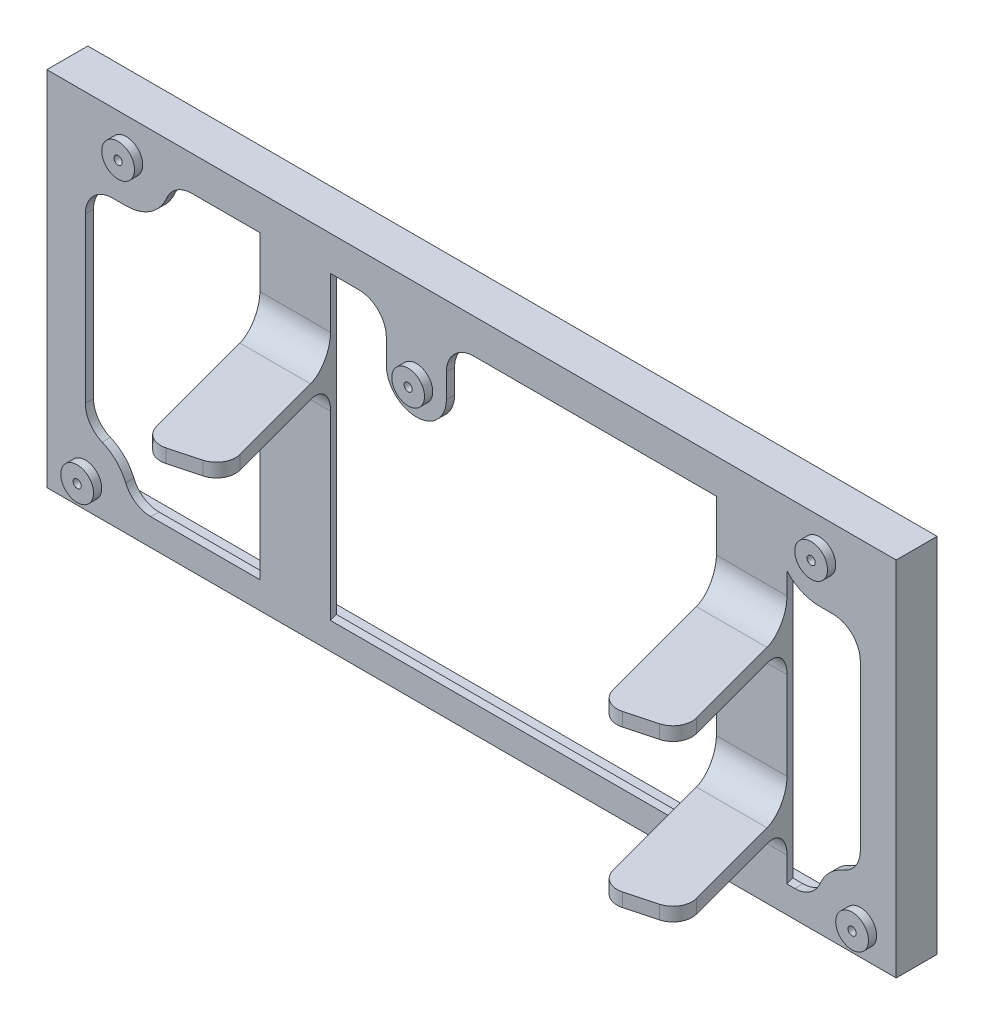
from build123d import *

# Parameters (mm, degrees)
SKETCH1_R                             = 6
SKETCH1_R_2                           = 1.5
DISPLAY_SCREW_PATTERN_DEPTH           = 3
DISPLAY_SCREW_PATTERN_2_DEPTH         = 3
DISPLAY_SCREW_PATTERN_3_DEPTH         = 3
DISPLAY_SCREW_PATTERN_4_DEPTH         = 3
DISPLAY_SCREW_PATTERN_5_DEPTH         = 3
SKETCH2_W                             = 311.1
SKETCH2_H                             = 132.6
SKETCH2_R                             = 4
DISPLAY_BACKPLANE_DEPTH               = 3
BACKPLANE_WEIGHT_REDUCTION_DEPTH      = 203.770122306
BACKPLANE_WEIGHT_REDUCTION_DEPTH_BACK = 203.770122306
SKETCH4_W                             = 311.1
SKETCH4_H                             = 132.6
SKETCH4_W_2                           = 309.1
SKETCH4_H_2                           = 130.6
DISPLAY_OUTSIDE_CRADDLE_DEPTH         = 12
BOTTOM_RADIO_MOUNT_TABS_DEPTH         = 5
TOP_RADIO_MOUNT_TABS_DEPTH            = 5
TOP_RADIO_MOUNT_TABS_2_DEPTH          = 5
BOSS_EXTRUDE6_REACH                   = 208.065
BOSS_EXTRUDE7_REACH                   = 211.446
BOSS_EXTRUDE8_REACH                   = 213.846
BOSS_EXTRUDE9_REACH                   = 205.9
TAB_FILLETS_10MM_R                    = 10


with BuildPart() as part:
    # Sketch1 → Display screw pattern (new body)
    with BuildSketch(Plane.XY):
        Circle(SKETCH1_R)
        Circle(SKETCH1_R_2, mode=Mode.SUBTRACT)
    extrude(amount=DISPLAY_SCREW_PATTERN_DEPTH)



with BuildPart() as body_2:
    # Sketch1 → Display screw pattern 2 (new body)
    with BuildSketch(Plane.XY):
        with Locations((-106.24, 18.83)):
            Circle(SKETCH1_R)
        with Locations((-106.24, 18.83)):
            Circle(SKETCH1_R_2, mode=Mode.SUBTRACT)
    extrude(amount=DISPLAY_SCREW_PATTERN_2_DEPTH)


with BuildPart() as body_3:
    # Sketch1 → Display screw pattern 3 (new body)
    with BuildSketch(Plane.XY):
        with Locations((147.61, 18.83)):
            Circle(SKETCH1_R)
        with Locations((147.61, 18.83)):
            Circle(SKETCH1_R_2, mode=Mode.SUBTRACT)
    extrude(amount=DISPLAY_SCREW_PATTERN_3_DEPTH)


with BuildPart() as body_4:
    # Sketch1 → Display screw pattern 4 (new body)
    with BuildSketch(Plane.XY):
        with Locations((-121.24, -91.25)):
            Circle(SKETCH1_R)
        with Locations((-121.24, -91.25)):
            Circle(SKETCH1_R_2, mode=Mode.SUBTRACT)
    extrude(amount=DISPLAY_SCREW_PATTERN_4_DEPTH)


with BuildPart() as body_5:
    # Sketch1 → Display screw pattern 5 (new body)
    with BuildSketch(Plane.XY):
        with Locations((162.61, -91.25)):
            Circle(SKETCH1_R)
        with Locations((162.61, -91.25)):
            Circle(SKETCH1_R_2, mode=Mode.SUBTRACT)
    extrude(amount=DISPLAY_SCREW_PATTERN_5_DEPTH)


with BuildPart() as part_1:
    add(part.part)

    add(body_2.part)  # Display backplane merges body 2

    add(body_3.part)  # Display backplane merges body 3

    add(body_4.part)  # Display backplane merges body 4

    add(body_5.part)  # Display backplane merges body 5
    # Sketch2 → Display backplane (add)
    with BuildSketch(Plane(origin=(0, 0, 0), x_dir=(-1, 0, 0), z_dir=(0, 0, -1))):
        with Locations((-20.21, -34.77)):
            Rectangle(SKETCH2_W, SKETCH2_H)
        with Locations((106.24, 18.83)):
            Circle(SKETCH2_R, mode=Mode.SUBTRACT)
        Circle(SKETCH2_R, mode=Mode.SUBTRACT)
        with Locations((121.24, -91.25)):
            Circle(SKETCH2_R, mode=Mode.SUBTRACT)
        with Locations((-147.61, 18.83)):
            Circle(SKETCH2_R, mode=Mode.SUBTRACT)
        with Locations((-162.61, -91.25)):
            Circle(SKETCH2_R, mode=Mode.SUBTRACT)
    extrude(amount=DISPLAY_BACKPLANE_DEPTH)

    # Sketch3 → Backplane weight reduction (cut, two sides: drawn at the far end of the back side and taken through both)
    with BuildSketch(Plane.XY.offset(-BACKPLANE_WEIGHT_REDUCTION_DEPTH_BACK)):
        with BuildLine():
            Line((162.61, -7.17), (162.61, -67.25))
            ThreePointArc((162.61, -67.25), (160.930502943, -72.797001962), (156.456153846, -76.480769231))
            ThreePointArc((156.456153846, -76.480769231), (151.296291501, -79.936291501), (147.840769231, -85.096153846))
            ThreePointArc((147.840769231, -85.096153846), (144.157001962, -89.570502943), (138.61, -91.25))
            Line((138.61, -91.25), (-97.24, -91.25))
            ThreePointArc((-97.24, -91.25), (-102.787001962, -89.570502943), (-106.470769231, -85.096153846))
            ThreePointArc((-106.470769231, -85.096153846), (-109.926291501, -79.936291501), (-115.086153846, -76.480769231))
            ThreePointArc((-115.086153846, -76.480769231), (-119.560502943, -72.797001962), (-121.24, -67.25))
            Line((-121.24, -67.25), (-121.24, -7.17))
            ThreePointArc((-121.24, -7.17), (-118.311067812, -0.098932188), (-111.24, 2.83))
            Line((-111.24, 2.83), (-106.24, 2.83))
            ThreePointArc((-106.24, 2.83), (-97.36479686, 5.517195291), (-91.470769231, 12.676153846))
            ThreePointArc((-91.470769231, 12.676153846), (-87.787001962, 17.150502943), (-82.24, 18.83))
            Line((-82.24, 18.83), (-21, 18.83))
            ThreePointArc((-21, 18.83), (-13.928932188, 15.901067812), (-11, 8.83))
            Line((-11, 8.83), (-11, 0))
            ThreePointArc((-11, 0), (0, -11), (11, 0))
            Line((11, 0), (11, 8.83))
            ThreePointArc((11, 8.83), (13.928932188, 15.901067812), (21, 18.83))
            Line((21, 18.83), (123.61, 18.83))
            ThreePointArc((123.61, 18.83), (129.157001962, 17.150502943), (132.840769231, 12.676153846))
            ThreePointArc((132.840769231, 12.676153846), (138.73479686, 5.517195291), (147.61, 2.83))
            Line((147.61, 2.83), (152.61, 2.83))
            ThreePointArc((152.61, 2.83), (159.681067812, -0.098932188), (162.61, -7.17))
        make_face()
    extrude(amount=BACKPLANE_WEIGHT_REDUCTION_DEPTH + BACKPLANE_WEIGHT_REDUCTION_DEPTH_BACK, mode=Mode.SUBTRACT)

    # Sketch4 → Display outside craddle (add)
    with BuildSketch(Plane(origin=(0, 0, -3), x_dir=(-1, 0, 0), z_dir=(0, 0, -1))):
        with Locations((-20.21, -34.77)):
            Rectangle(SKETCH4_W, SKETCH4_H)
        with Locations((-20.21, -34.77)):
            Rectangle(SKETCH4_W_2, SKETCH4_H_2, mode=Mode.SUBTRACT)
    extrude(amount=DISPLAY_OUTSIDE_CRADDLE_DEPTH)

    # Sketch9 → Boss-Extrude6 (add, up to next)
    with BuildSketch(Plane(origin=(0, -9.845, 0), x_dir=(1, 0, 0), z_dir=(0, 1, 0)), mode=Mode.PRIVATE) as boss_extrude6_sk1:
        Polygon((109.074247912, 3), (134.956152423, 3), (135.76, 0), (109.87809549, 0), align=None)
    boss_extrude6_tool1 = extrude(boss_extrude6_sk1.sketch, amount=BOSS_EXTRUDE6_REACH, mode=Mode.PRIVATE) - part_1.part
    # Sketch9 → Boss-Extrude6 (add, up to next)
    with BuildSketch(Plane(origin=(0, -9.845, 0), x_dir=(1, 0, 0), z_dir=(0, 1, 0)), mode=Mode.PRIVATE) as boss_extrude6_sk2:
        Polygon((-58.122855224, 3), (-32.240950714, 3), (-31.437103136, 0), (-57.319007646, 0), align=None)
    boss_extrude6_tool2 = extrude(boss_extrude6_sk2.sketch, amount=BOSS_EXTRUDE6_REACH, mode=Mode.PRIVATE) - part_1.part


with BuildPart() as body_2_2:
    # Sketch5 → Bottom radio mount tabs (new body)
    with BuildSketch(Plane(origin=(0, -72.095, 0), x_dir=(1, 0, 0), z_dir=(0, 1, 0))):
        with BuildLine():
            Line((134.956152423, 3), (147.909153247, -45.341257188))
            ThreePointArc((147.909153247, -45.341257188), (147.20985029, -50.652990504), (142.959405779, -53.914471288))
            Line((142.959405779, -53.914471288), (132.33422169, -56.761480784))
            ThreePointArc((132.33422169, -56.761480784), (127.022488374, -56.062177826), (123.76100759, -51.811733316))
            Line((123.76100759, -51.811733316), (109.074247912, 3))
            Line((109.074247912, 3), (134.956152423, 3))
        make_face()
    extrude(amount=BOTTOM_RADIO_MOUNT_TABS_DEPTH)


with BuildPart() as body_3_2:
    # Sketch7 → Top radio mount tabs (new body)
    with BuildSketch(Plane(origin=(0, -14.845, 0), x_dir=(1, 0, 0), z_dir=(0, 1, 0))):
        with BuildLine():
            Line((-32.240950714, 3), (-19.287949889, -45.341257188))
            ThreePointArc((-19.287949889, -45.341257188), (-19.987252846, -50.652990504), (-24.237697357, -53.914471288))
            Line((-24.237697357, -53.914471288), (-34.862881446, -56.761480784))
            ThreePointArc((-34.862881446, -56.761480784), (-40.174614762, -56.062177826), (-43.436095546, -51.811733316))
            Line((-43.436095546, -51.811733316), (-58.122855224, 3))
            Line((-58.122855224, 3), (-32.240950714, 3))
        make_face()
    extrude(amount=TOP_RADIO_MOUNT_TABS_DEPTH)


with BuildPart() as body_4_2:
    # Sketch7 → Top radio mount tabs 2 (new body)
    with BuildSketch(Plane(origin=(0, -14.845, 0), x_dir=(1, 0, 0), z_dir=(0, 1, 0))):
        with BuildLine():
            Line((132.33422169, -56.761480784), (142.959405779, -53.914471288))
            ThreePointArc((142.959405779, -53.914471288), (147.20985029, -50.652990504), (147.909153247, -45.341257188))
            Line((147.909153247, -45.341257188), (134.956152423, 3))
            Line((134.956152423, 3), (109.074247912, 3))
            Line((109.074247912, 3), (123.76100759, -51.811733316))
            ThreePointArc((123.76100759, -51.811733316), (127.022488374, -56.062177826), (132.33422169, -56.761480784))
        make_face()
    extrude(amount=TOP_RADIO_MOUNT_TABS_2_DEPTH)


with BuildPart() as part_2:
    add(part_1.part)

    add(body_3_2.part)  # Boss-Extrude6 merges body 3 2

    add(body_4_2.part)  # Boss-Extrude6 merges body 4 2
    add(boss_extrude6_tool1.solids().sort_by_distance((122.417124, -9.845, -1.5))[0])
    add(boss_extrude6_tool2.solids().sort_by_distance((-44.779979, -9.845, -1.5))[0])

    # Sketch10 → Boss-Extrude7 (add, up to next)
    with BuildSketch(Plane(origin=(0, -67.095, 0), x_dir=(1, 0, 0), z_dir=(0, 1, 0)), mode=Mode.PRIVATE) as boss_extrude7_sk1:
        Polygon((109.074247912, 3), (109.87809549, 0), (135.76, 0), (134.956152423, 3), align=None)
    boss_extrude7_tool1 = extrude(boss_extrude7_sk1.sketch, amount=BOSS_EXTRUDE7_REACH, mode=Mode.PRIVATE) - part_2.part

    add(body_2_2.part)  # Boss-Extrude7 merges body 2 2
    add(boss_extrude7_tool1.solids().sort_by_distance((122.417124, -67.095, -1.5))[0])

    # Sketch11 → Boss-Extrude8 (add, up to next)
    with BuildSketch(Plane.XZ.offset(72.095), mode=Mode.PRIVATE) as boss_extrude8_sk1:
        Polygon((134.956152423, -3), (109.074247912, -3), (109.87809549, 0), (135.76, 0), align=None)
    boss_extrude8_tool1 = extrude(boss_extrude8_sk1.sketch, amount=BOSS_EXTRUDE8_REACH, mode=Mode.PRIVATE) - part_2.part
    add(boss_extrude8_tool1.solids().sort_by_distance((122.417124, -72.095, -1.5))[0])

    # Sketch12 → Boss-Extrude9 (add, up to next)
    with BuildSketch(Plane.XZ.offset(14.845), mode=Mode.PRIVATE) as boss_extrude9_sk1:
        Polygon((-32.240950714, -3), (-58.122855224, -3), (-57.319007646, 0), (-31.437103136, 0), align=None)
    boss_extrude9_tool1 = extrude(boss_extrude9_sk1.sketch, amount=BOSS_EXTRUDE9_REACH, mode=Mode.PRIVATE) - part_2.part
    add(boss_extrude9_tool1.solids().sort_by_distance((-44.779979, -14.845, -1.5))[0])

    # Tab fillets 10mm
    tab_fillets_10mm_edges = [part_2.edges().sort_by_distance(p)[0] for p in [
        (122.819047745, -9.845, 0),
        (-44.378055391, -9.845, 0),
        (122.819047745, -14.845, 0),
        (122.819047745, -67.095, 0),
        (122.819047745, -72.095, 0),
        (-44.378055391, -14.845, 0),
    ]]
    fillet(tab_fillets_10mm_edges, radius=TAB_FILLETS_10MM_R)


solid = part_2.part
